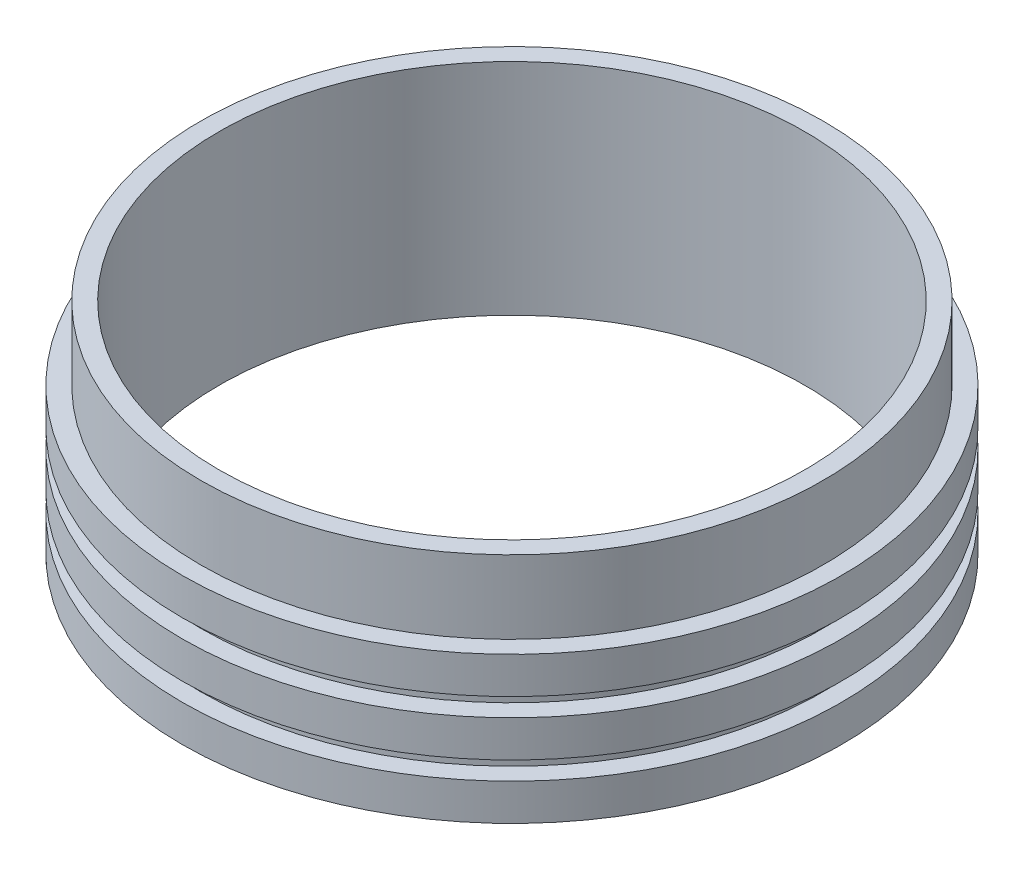
from build123d import *

# Parameters (mm, degrees)
SKETCH_1_R          = 9
EXTRUDE_1_DEPTH     = 4.5
SKETCH_2_W          = 1
SKETCH_2_H          = 0.5
SKETCH_4_R          = 8
CUT_EXTRUDE_1_DEPTH = 4.5
EXTRUDE_START       = 1.5
SKETCH_6_R          = 8.5
SKETCH_6_R_2        = 8
EXTRUDE_3_DEPTH     = 1.5


with BuildPart() as part:
    # 草图1 → 凸台-拉伸1 (new body)
    with BuildSketch(Plane(origin=(0, 0, 0), x_dir=(1, 0, 0), z_dir=(0, 1, 0))):
        with Locations(Location((0, 0, 0), (0, 0, 270))):
            Circle(SKETCH_1_R)
    extrude(amount=EXTRUDE_1_DEPTH)

    # 切除-扫描1: sweep along a path in 草图3
    with BuildLine(Plane(origin=(0, 4.5, 0), x_dir=(1, 0, 0), z_dir=(0, 1, 0))) as sweep_1_path:
        CenterArc((0, 0), 9, 0, 360)
    # 草图2 → 切除-扫描1 (sweep, cut)
    with BuildSketch(Plane(origin=(0, 0, 0), x_dir=(0, 0, -1), z_dir=(1, 0, 0))):
        with Locations((-9, 4.25)):
            Rectangle(SKETCH_2_W, SKETCH_2_H)
        with Locations((-9, 2.75)):
            Rectangle(SKETCH_2_W, SKETCH_2_H)
        with Locations((-9, 1.25)):
            Rectangle(SKETCH_2_W, SKETCH_2_H)
    sweep(path=sweep_1_path.line, mode=Mode.SUBTRACT)

    # 草图4 → 切除-拉伸1 (cut)
    with BuildSketch(Plane(origin=(0, 4.5, 0), x_dir=(1, 0, 0), z_dir=(0, 1, 0))):
        with Locations(Location((0, 0, 0), (0, 0, 270))):
            Circle(SKETCH_4_R)
    extrude(amount=-CUT_EXTRUDE_1_DEPTH, mode=Mode.SUBTRACT)

    # 草图6 → 凸台-拉伸3 (add)
    with BuildSketch(Plane(origin=(0, 4.5, 0), x_dir=(1, 0, 0), z_dir=(0, 1, 0)).offset(EXTRUDE_START)):
        with Locations(Location((0, 0, 0), (0, 0, 270))):
            Circle(SKETCH_6_R)
        with Locations(Location((0, 0, 0), (0, 0, 270))):
            Circle(SKETCH_6_R_2, mode=Mode.SUBTRACT)
    extrude(amount=-EXTRUDE_3_DEPTH)


solid = part.part
